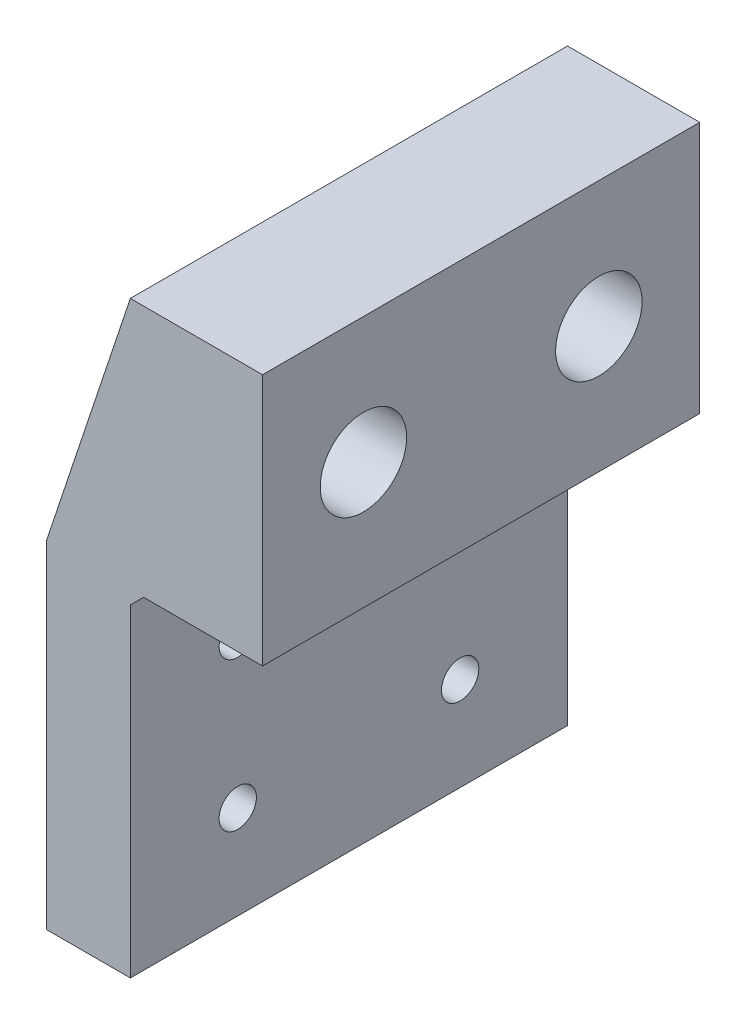
from build123d import *

# Parameters (mm, degrees)
SKETCH1_W                = 33.02
SKETCH1_H                = 25.4
SKETCH1_R                = 1.4097
BOSS_EXTRUDE1_DEPTH      = 6.35
SKETCH2_W                = 33.02
SKETCH2_H                = 19.05
BOSS_EXTRUDE2_DEPTH      = 9.983600048
BOSS_EXTRUDE3_DEPTH      = 33.02
F_0_257_DIAMETER_HOLE1_D = 6.5278
CUT_EXTRUDE1_DEPTH       = 7.62
CHAMFER1_SIZE            = 1


with BuildPart() as part:
    # Sketch1 → Boss-Extrude1 (new body)
    with BuildSketch(Plane(origin=(0, 0, 0), x_dir=(0, 0, -1), z_dir=(1, 0, 0))):
        with Locations((16.51, -12.7)):
            Rectangle(SKETCH1_W, SKETCH1_H)
        with Locations((8.111016524, -7.0739)):
            Circle(SKETCH1_R, mode=Mode.SUBTRACT)
        with Locations((8.111016524, -18.3261)):
            Circle(SKETCH1_R, mode=Mode.SUBTRACT)
        with Locations((24.908983476, -18.3261)):
            Circle(SKETCH1_R, mode=Mode.SUBTRACT)
        with Locations((24.908983476, -7.0739)):
            Circle(SKETCH1_R, mode=Mode.SUBTRACT)
    extrude(amount=BOSS_EXTRUDE1_DEPTH)



with BuildPart() as body_2:
    # Sketch2 → Boss-Extrude2 (new body)
    with BuildSketch(Plane(origin=(6.35, 0, 0), x_dir=(0, 0, -1), z_dir=(1, 0, 0))):
        with Locations((16.51, 9.525)):
            Rectangle(SKETCH2_W, SKETCH2_H)
    extrude(amount=BOSS_EXTRUDE2_DEPTH)


with BuildPart() as part_1:
    add(part.part)

    add(body_2.part)  # Boss-Extrude3 merges body 2
    # Sketch3 → Boss-Extrude3 (add)
    with BuildSketch(Plane.XY):
        Polygon((6.35, 19.05), (0, 0), (6.35, 0), align=None)
    extrude(amount=-BOSS_EXTRUDE3_DEPTH)

    # F (0.257) Diameter Hole1 (through all)
    with Locations(Plane(origin=(16.333600048, 0, 0), x_dir=(0, 0, -1), z_dir=(1, 0, 0))):
        with Locations((7.62, 9.525), (25.4, 9.525)):
            Hole(F_0_257_DIAMETER_HOLE1_D / 2)

    # Sketch11 → Cut-Extrude1 (cut)
    with BuildSketch(Plane.ZY):
        with BuildLine():
            Line((-25.4, 15.113), (-7.62, 15.113))
            ThreePointArc((-7.62, 15.113), (-2.032, 9.525), (-7.62, 3.937))
            Line((-7.62, 3.937), (-25.4, 3.937))
            ThreePointArc((-25.4, 3.937), (-30.988, 9.525), (-25.4, 15.113))
        make_face()
    extrude(amount=-CUT_EXTRUDE1_DEPTH, mode=Mode.SUBTRACT)

    # Chamfer1
    chamfer1_edges = [part_1.edges().sort_by_distance(p)[0] for p in [
        (6.35, 0, -16.51),
    ]]
    chamfer(chamfer1_edges, length=CHAMFER1_SIZE)


solid = part_1.part
